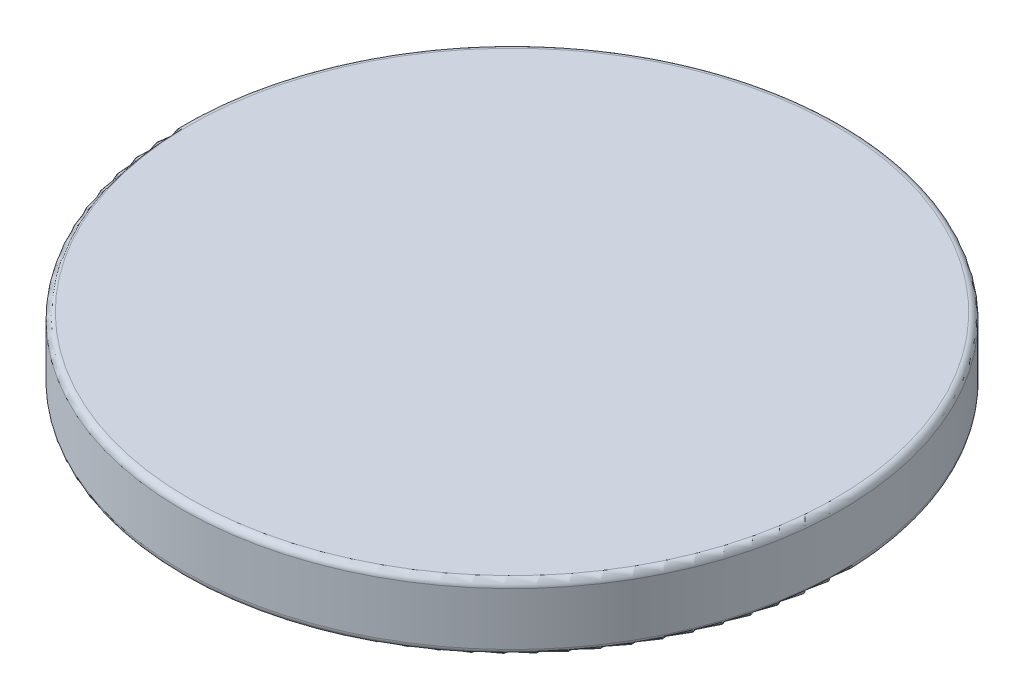
from build123d import *

# Parameters (mm, degrees)
BASES_R      = 10
BASE_DEPTH   = 1
BASEFILLET_R = 0.2


with BuildPart() as part:
    # BaseS → Base (new, symmetric)
    with BuildSketch(Plane(origin=(0, 0, 0), x_dir=(1, 0, 0), z_dir=(0, 1, 0))):
        Circle(BASES_R)
    extrude(amount=BASE_DEPTH, both=True)

    # BaseFillet
    basefillet_edges = [part.edges().sort_by_distance(p)[0] for p in [
        (-10, -1, 0),
        (-10, 1, 0),
    ]]
    fillet(basefillet_edges, radius=BASEFILLET_R)


solid = part.part
